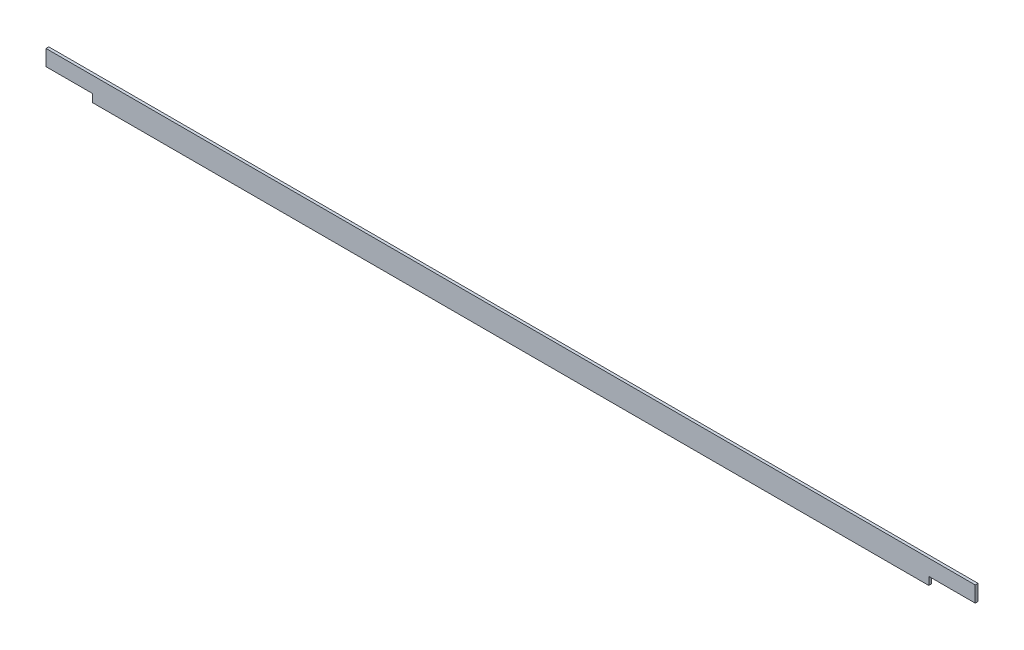
from build123d import *

# Parameters (mm, degrees)
SKETCH2_W           = 900
SKETCH2_H           = 8.5
SKETCH2_W_2         = 1000
SKETCH2_H_2         = 17
BOSS_EXTRUDE1_DEPTH = 1.5


with BuildPart() as part:
    # Sketch2 → Boss-Extrude1 (new, symmetric)
    with BuildSketch(Plane.XY):
        with Locations((0, -12.75)):
            Rectangle(SKETCH2_W, SKETCH2_H)
        Rectangle(SKETCH2_W_2, SKETCH2_H_2)
    extrude(amount=BOSS_EXTRUDE1_DEPTH, both=True)


solid = part.part
